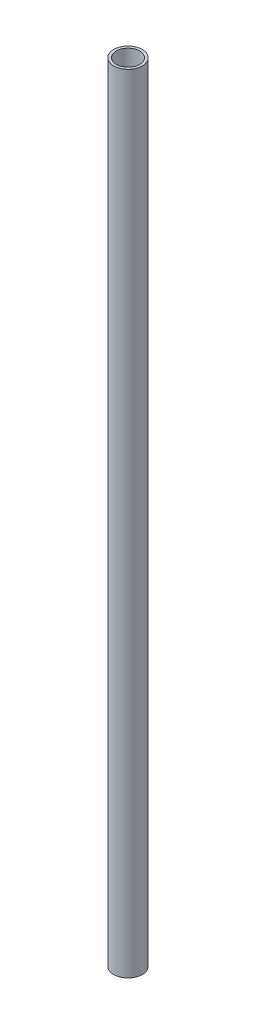
from build123d import *

# Parameters (mm, degrees)
SKETCH1_R           = 21.082
SKETCH1_R_2         = 17.272
BOSS_EXTRUDE1_DEPTH = 1160.4625


with BuildPart() as part:
    # Sketch1 → Boss-Extrude1 (new body)
    with BuildSketch(Plane(origin=(0, 0, 0), x_dir=(1, 0, 0), z_dir=(0, 1, 0))):
        with Locations(Location((0, 0, 0), (0, 0, 270))):
            Circle(SKETCH1_R)
        with Locations(Location((0, 0, 0), (0, 0, 270))):
            Circle(SKETCH1_R_2, mode=Mode.SUBTRACT)
    extrude(amount=BOSS_EXTRUDE1_DEPTH)


solid = part.part
